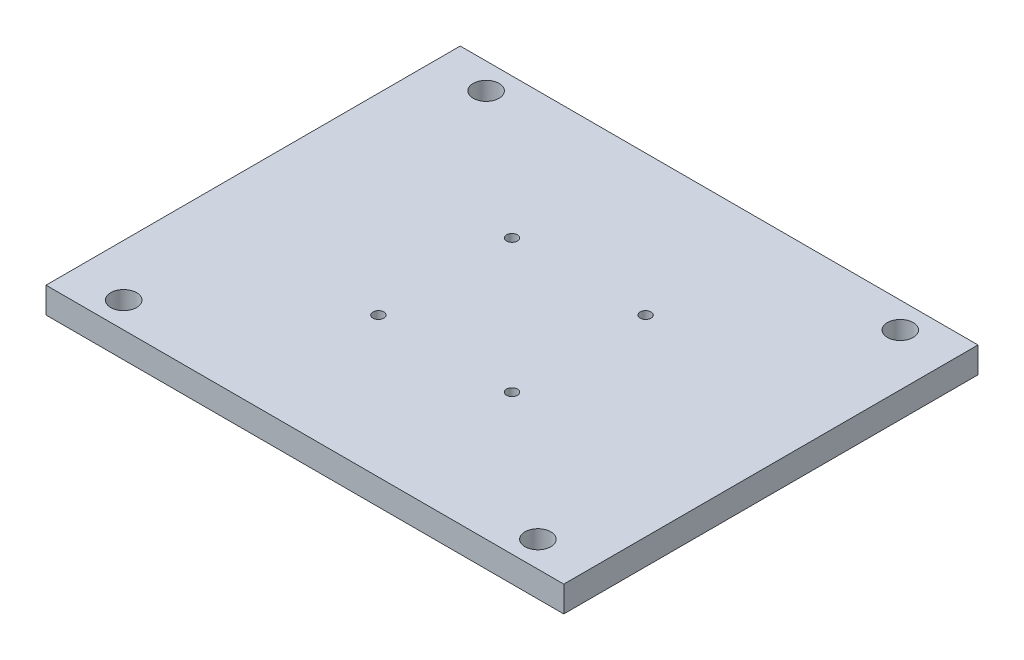
from build123d import *

# Parameters (mm, degrees)
BOSS_EXTRUDE1_DEPTH      = 5
BOSS_EXTRUDE1_DEPTH_BACK = 5
SKETCH1_W                = 200
SKETCH1_H                = 160
SKETCH2_R                = 5
SKETCH2_R_2              = 2.1
CUT_EXTRUDE1_DEPTH       = 257.32011236


with BuildPart() as part:
    # Sketch1 → Boss-Extrude1 (new, two sides: drawn at the far end of the back side and taken through both)
    with BuildSketch(Plane(origin=(0, 0, 0), x_dir=(1, 0, 0), z_dir=(0, 1, 0)).offset(-BOSS_EXTRUDE1_DEPTH_BACK)):
        with Locations((100, 80)):
            Rectangle(SKETCH1_W, SKETCH1_H)
    extrude(amount=BOSS_EXTRUDE1_DEPTH + BOSS_EXTRUDE1_DEPTH_BACK)

    # Sketch2 → Cut-Extrude1 (cut, through all)
    with BuildSketch(Plane(origin=(0, 5, 0), x_dir=(1, 0, 0), z_dir=(0, 1, 0))):
        with Locations((180, 150)):
            Circle(SKETCH2_R)
        with Locations((74.197673555, 105.802326445)):
            Circle(SKETCH2_R_2)
        with Locations((74.197673555, 54.197673555)):
            Circle(SKETCH2_R_2)
        with Locations((125.802326445, 54.197673555)):
            Circle(SKETCH2_R_2)
        with Locations((125.802326445, 105.802326445)):
            Circle(SKETCH2_R_2)
        with Locations((180, 10)):
            Circle(SKETCH2_R)
        with Locations((20, 10)):
            Circle(SKETCH2_R)
        with Locations((20, 150)):
            Circle(SKETCH2_R)
    extrude(amount=-CUT_EXTRUDE1_DEPTH, mode=Mode.SUBTRACT)


solid = part.part
